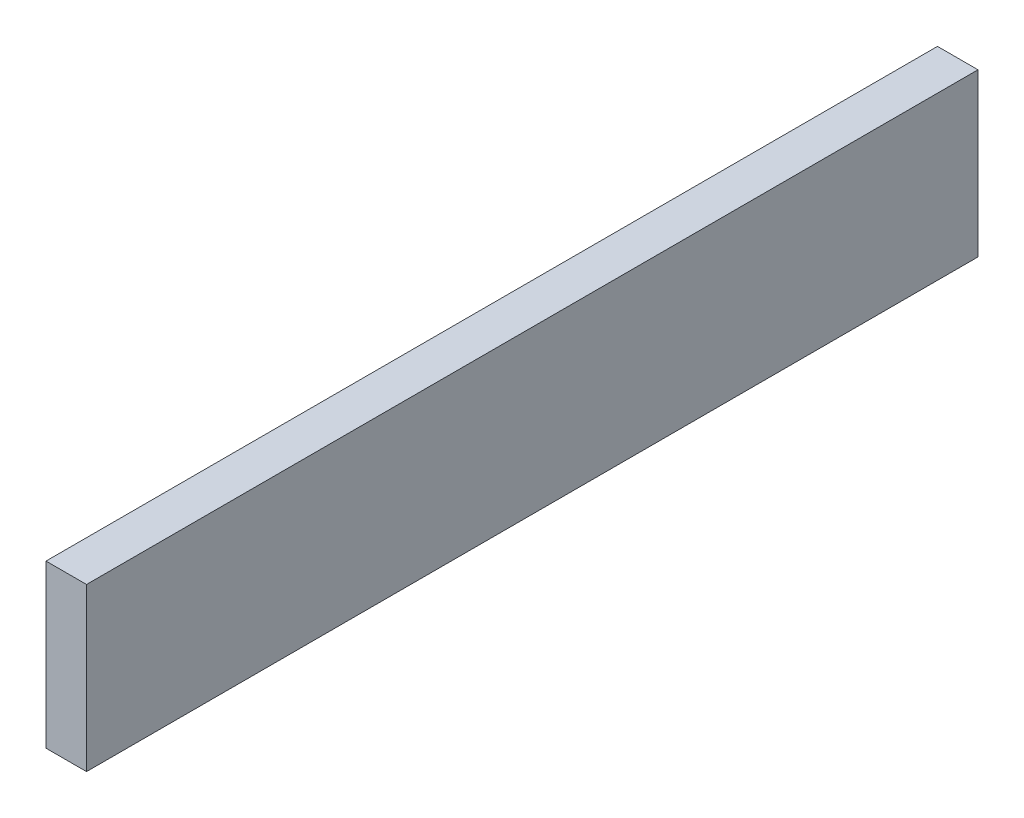
from build123d import *

# Parameters (mm, degrees)
SKETCH1_W           = 6.35
SKETCH1_H           = 25.4
BOSS_EXTRUDE1_DEPTH = 139.7


with BuildPart() as part:
    # Sketch1 → Boss-Extrude1 (new body)
    with BuildSketch(Plane.XY):
        with Locations((3.175, 12.7)):
            Rectangle(SKETCH1_W, SKETCH1_H)
    extrude(amount=BOSS_EXTRUDE1_DEPTH)


solid = part.part
